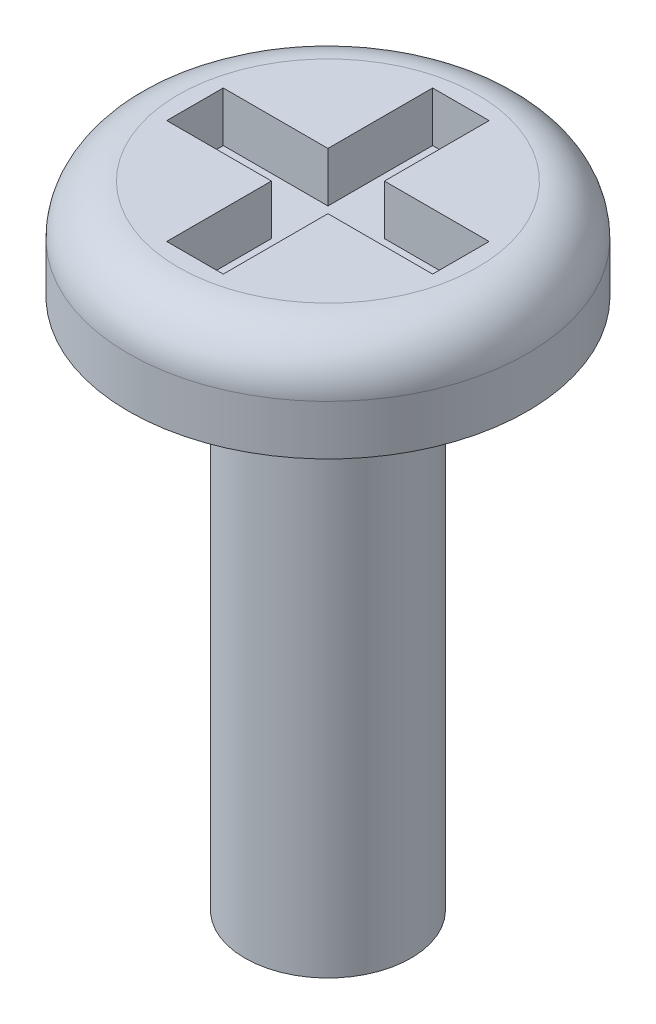
from build123d import *

# Parameters (mm, degrees)
SKETCH3_R           = 1.25
BOSS_EXTRUDE1_DEPTH = 8
SKETCH4_R           = 3
BOSS_EXTRUDE2_DEPTH = 1.5
FILLET3_R           = 0.75
CUT_EXTRUDE4_DEPTH  = 0.75


with BuildPart() as part:
    # Sketch3 → Boss-Extrude1 (new body)
    with BuildSketch(Plane(origin=(0, 0, 0), x_dir=(1, 0, 0), z_dir=(0, 1, 0))):
        with Locations(Location((0, 0, 0), (0, 0, 270))):
            Circle(SKETCH3_R)
    extrude(amount=BOSS_EXTRUDE1_DEPTH)

    # Sketch4 → Boss-Extrude2 (add)
    with BuildSketch(Plane(origin=(0, 8, 0), x_dir=(1, 0, 0), z_dir=(0, 1, 0))):
        with Locations(Location((0, 0, 0), (0, 0, 270))):
            Circle(SKETCH4_R)
    extrude(amount=BOSS_EXTRUDE2_DEPTH)

    # Fillet3
    fillet3_edges = [part.edges().sort_by_distance(p)[0] for p in [
        (0, 9.5, -3),
    ]]
    fillet(fillet3_edges, radius=FILLET3_R)

    # Sketch6 → Cut-Extrude4 (cut)
    with BuildSketch(Plane(origin=(0, 9.5, 0), x_dir=(1, 0, 0), z_dir=(0, 1, 0))):
        Polygon((0.425, 0.425), (2, 0.425), (2, -0.425), (0.425, -0.425), (0.425, -2), (-0.425, -2), (-0.425, -0.425), (-2, -0.425), (-2, 0.425), (-0.425, 0.425), (-0.425, 2), (0.425, 2), align=None)
    extrude(amount=-CUT_EXTRUDE4_DEPTH, mode=Mode.SUBTRACT)


solid = part.part
